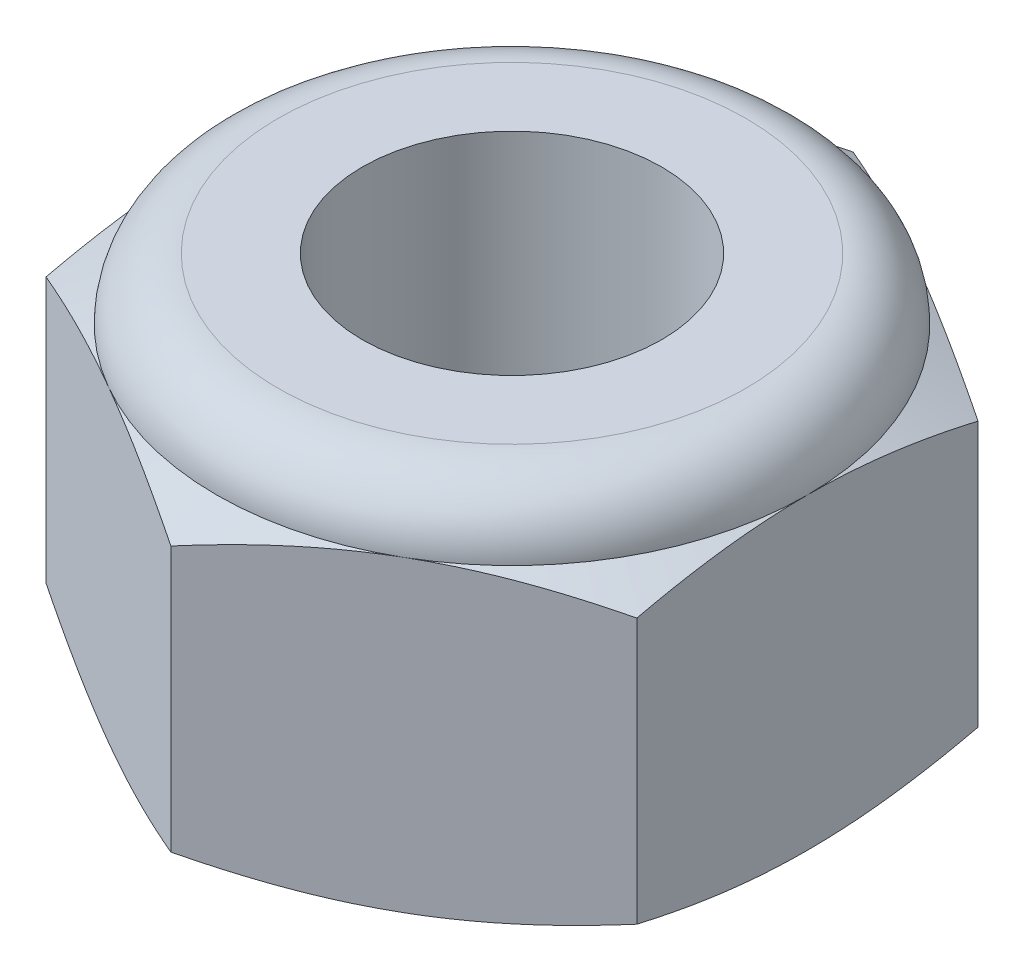
from build123d import *

# Parameters (mm, degrees)
EXTRUDE1_DEPTH = 5.953125
SKETCH2_W      = 2.413
SKETCH2_H      = 5.953125


with BuildPart() as part:
    # Sketch1 → Extrude1 (new body)
    with BuildSketch(Plane(origin=(0, 0, 0), x_dir=(1, 0, 0), z_dir=(0, 1, 0))):
        Polygon((0, 5.499261314), (-4.7625, 2.749630657), (-4.7625, -2.749630657), (0, -5.499261314), (4.7625, -2.749630657), (4.7625, 2.749630657), align=None)
    extrude(amount=EXTRUDE1_DEPTH)


with BuildPart() as body_2:
    # Sketch2 → Revolve1 (revolve)
    with BuildSketch(Plane(origin=(0, 0, 0), x_dir=(0, 0, -1), z_dir=(1, 0, 0))):
        with Locations((1.2065, 2.9765625)):
            Rectangle(SKETCH2_W, SKETCH2_H)
    revolve(axis=Axis((0, -2.413, 0), (0, 1, 0)))


with BuildPart() as part_1:
    add(part.part)

    # Combine1: cut body 2
    add(body_2.part, mode=Mode.SUBTRACT)

    # Sketch5 → Cut-Revolve3 (revolve, cut)
    with BuildSketch(Plane(origin=(0, 0, 0), x_dir=(0, 0, -1), z_dir=(1, 0, 0))):
        with BuildLine():
            Line((0, 0), (4.7625, 0))
            Line((4.7625, 0), (5.499261314, 0.343557443))
            Line((5.499261314, 0.343557443), (5.499261314, 4.617380057))
            Line((5.499261314, 4.617380057), (4.7625, 4.9609375))
            ThreePointArc((4.7625, 4.9609375), (4.471895009, 5.662520009), (3.7703125, 5.953125))
            Line((3.7703125, 5.953125), (3.7703125, 7.223125))
            Line((3.7703125, 7.223125), (6.769261314, 7.223125))
            Line((6.769261314, 7.223125), (6.769261314, -1.27))
            Line((6.769261314, -1.27), (0, -1.27))
            Line((0, -1.27), (0, 0))
        make_face()
    revolve(axis=Axis((0, 0, 0), (0, 1, 0)), mode=Mode.SUBTRACT)


solid = part_1.part
